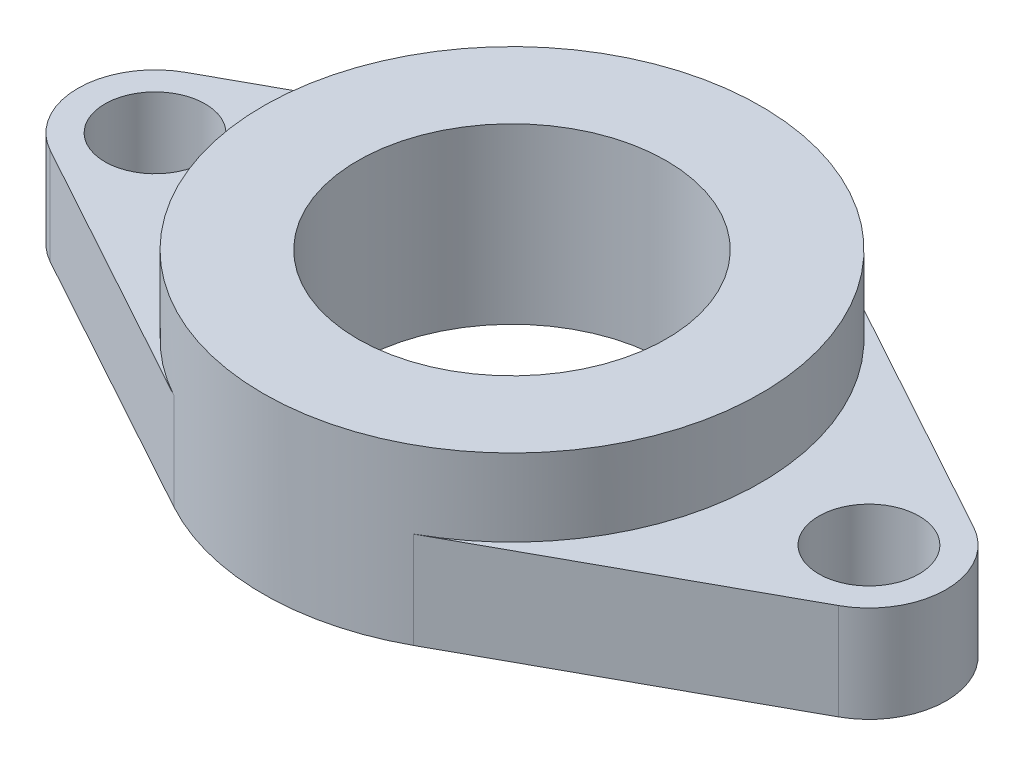
from build123d import *

# Parameters (mm, degrees)
SKETCH_3_R               = 12.9
EXTRUDE_1_DEPTH          = 9
EXTRUDE_2_DEPTH          = 5
SKETCH_5_R               = 6.1
EXTRUDE_3_DEPTH          = 2.5
SKETCH_6_R               = 4
CUT_EXTRUDE_1_DEPTH      = 29.370936
SKETCH_7_R               = 2.6
CUT_EXTRUDE_2_DEPTH      = 27.737801
CUT_EXTRUDE_3_DEPTH      = 17
CUT_EXTRUDE_3_DEPTH_BACK = 15
SKETCH_8_R               = 8


with BuildPart() as part:
    # 草图3 → 凸台-拉伸1 (new body)
    with BuildSketch(Plane(origin=(0, 0, 0), x_dir=(1, 0, 0), z_dir=(0, 1, 0))):
        with Locations(Location((0, 0, 0), (0, 0, 270))):
            Circle(SKETCH_3_R)
    extrude(amount=EXTRUDE_1_DEPTH)

    # 草图4 → 凸台-拉伸2 (add)
    with BuildSketch(Plane(origin=(0, 0, 0), x_dir=(1, 0, 0), z_dir=(0, 1, 0))):
        with BuildLine():
            Line((-20.424324, 3.506704), (-6.205946, 11.309122))
            ThreePointArc((-6.205946, 11.309122), (0, 12.9), (6.205946, 11.309122))
            Line((6.205946, 11.309122), (20.424324, 3.506704))
            ThreePointArc((20.424324, 3.506704), (22.5, 0), (20.424324, -3.506704))
            Line((20.424324, -3.506704), (6.205946, -11.309122))
            ThreePointArc((6.205946, -11.309122), (0, -12.9), (-6.205946, -11.309122))
            Line((-6.205946, -11.309122), (-20.424324, -3.506704))
            ThreePointArc((-20.424324, -3.506704), (-22.5, 0), (-20.424324, 3.506704))
        make_face()
    extrude(amount=EXTRUDE_2_DEPTH)

    # 草图5 → 凸台-拉伸3 (add)
    with BuildSketch(Plane(origin=(0, 9, 0), x_dir=(1, 0, 0), z_dir=(0, 1, 0))):
        with Locations(Location((0, 0, 0), (0, 0, 270))):
            Circle(SKETCH_5_R)
    extrude(amount=EXTRUDE_3_DEPTH)

    # 草图6 → 切除-拉伸1 (cut, through all)
    with BuildSketch(Plane(origin=(0, 11.5, 0), x_dir=(1, 0, 0), z_dir=(0, 1, 0))):
        with Locations(Location((0, 0, 0), (0, 0, 270))):
            Circle(SKETCH_6_R)
    extrude(amount=-CUT_EXTRUDE_1_DEPTH, mode=Mode.SUBTRACT)

    # 草图7 → 切除-拉伸2 (cut, through all)
    with BuildSketch(Plane(origin=(0, 5, 0), x_dir=(1, 0, 0), z_dir=(0, 1, 0))):
        with Locations(Location((18.5, 0, 0), (0, 0, 270))):
            Circle(SKETCH_7_R)
        with Locations(Location((-18.5, 0, 0), (0, 0, 270))):
            Circle(SKETCH_7_R)
    extrude(amount=-CUT_EXTRUDE_2_DEPTH, mode=Mode.SUBTRACT)

    # 草图8 → 切除-拉伸3 (cut, two sides: drawn at the far end of the back side and taken through both)
    with BuildSketch(Plane(origin=(0, 9, 0), x_dir=(1, 0, 0), z_dir=(0, 1, 0)).offset(-CUT_EXTRUDE_3_DEPTH_BACK)):
        with Locations(Location((0, 0, 0), (0, 0, 270))):
            Circle(SKETCH_8_R)
    extrude(amount=CUT_EXTRUDE_3_DEPTH + CUT_EXTRUDE_3_DEPTH_BACK, mode=Mode.SUBTRACT)


solid = part.part
